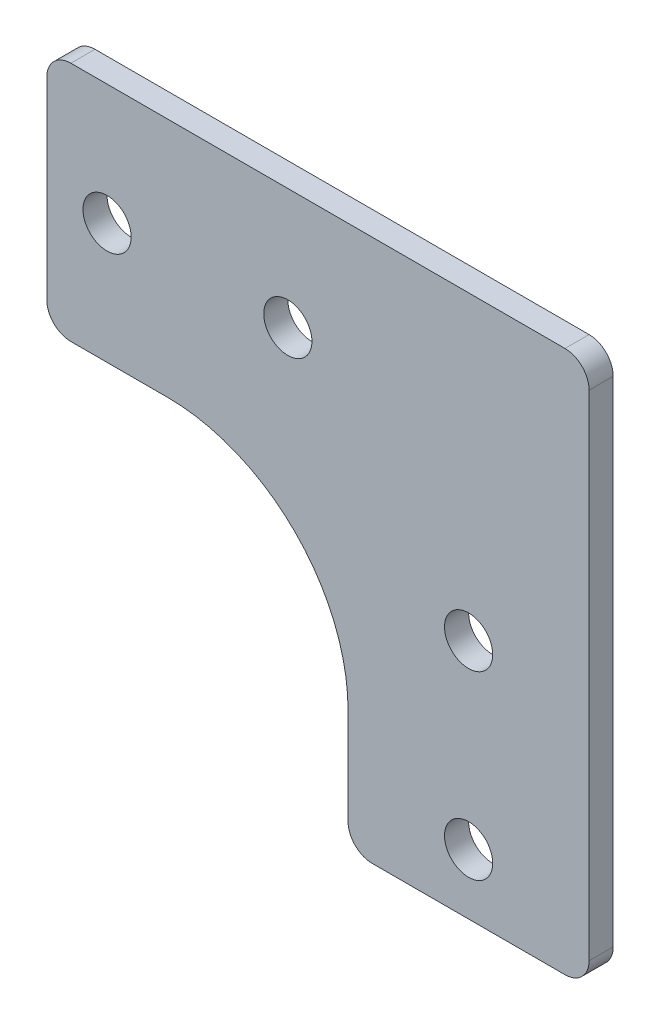
from build123d import *

# Parameters (mm, degrees)
EXTRUDE_1_DEPTH     = 2
SKETCH_2_R          = 2
CUT_EXTRUDE_1_DEPTH = 2
FILLET_1_R          = 2


with BuildPart() as part:
    # 草图1 → 凸台-拉伸1 (new body)
    with BuildSketch(Plane.XY):
        with BuildLine():
            Line((0, 0), (0, -45))
            Line((0, -45), (-20, -45))
            Line((-20, -45), (-20, -35))
            ThreePointArc((-20, -35), (-24.393398282, -24.393398282), (-35, -20))
            Line((-35, -20), (-45, -20))
            Line((-45, -20), (-45, 0))
            Line((-45, 0), (0, 0))
        make_face()
    extrude(amount=EXTRUDE_1_DEPTH)

    # 草图2 → 切除-拉伸1 (cut)
    with BuildSketch(Plane.XY.offset(2)):
        with Locations((-10, -40)):
            Circle(SKETCH_2_R)
        with Locations((-10, -25)):
            Circle(SKETCH_2_R)
        with Locations((-25, -10)):
            Circle(SKETCH_2_R)
        with Locations((-40, -10)):
            Circle(SKETCH_2_R)
    extrude(amount=-CUT_EXTRUDE_1_DEPTH, mode=Mode.SUBTRACT)

    # 圆角1
    fillet_1_edges = [part.edges().sort_by_distance(p)[0] for p in [
        (0, 0, 1),
        (0, -45, 1),
        (-20, -45, 1),
        (-45, -20, 1),
        (-45, 0, 1),
    ]]
    fillet(fillet_1_edges, radius=FILLET_1_R)


solid = part.part
